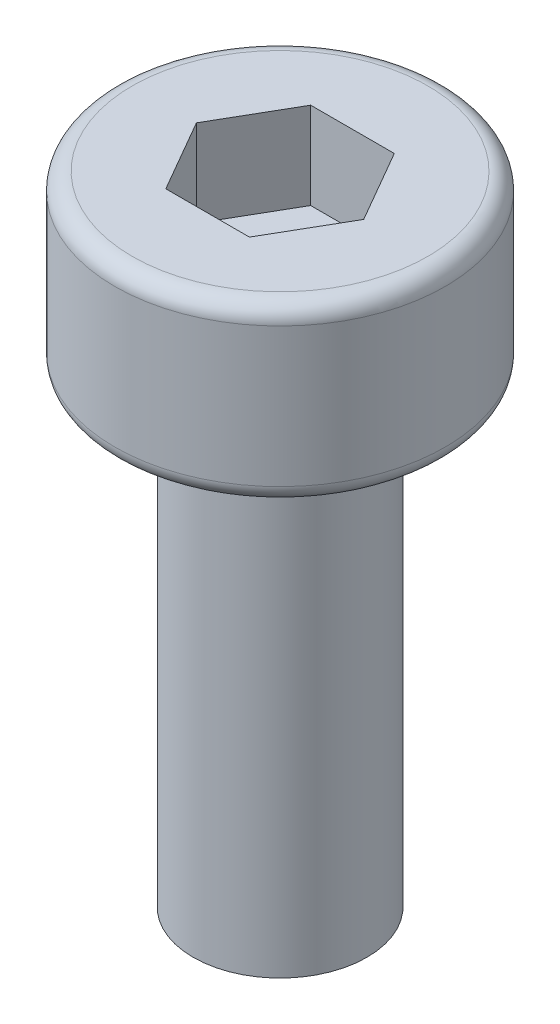
from build123d import *

# Parameters (mm, degrees)
SKETCH_1_R          = 2.85
EXTRUDE_1_DEPTH     = 3
SKETCH_2_R          = 1.5
EXTRUDE_2_DEPTH     = 8
FILLET_1_R          = 0.3
CUT_EXTRUDE_1_DEPTH = 1.5


with BuildPart() as part:
    # 草图1 → 凸台-拉伸1 (new body)
    with BuildSketch(Plane(origin=(0, 0, 0), x_dir=(1, 0, 0), z_dir=(0, 1, 0))):
        with Locations(Location((0, 0, 0), (0, 0, 270))):
            Circle(SKETCH_1_R)
    extrude(amount=EXTRUDE_1_DEPTH)

    # 草图2 → 凸台-拉伸2 (add)
    with BuildSketch(Plane.XZ):
        with Locations(Location((0, 0, 0), (0, 0, 90))):
            Circle(SKETCH_2_R)
    extrude(amount=EXTRUDE_2_DEPTH)

    # 圆角1
    fillet_1_edges = [part.edges().sort_by_distance(p)[0] for p in [
        (0, 0, -2.85),
        (0, 3, -2.85),
    ]]
    fillet(fillet_1_edges, radius=FILLET_1_R)

    # 草图3 → 切除-拉伸1 (cut)
    with BuildSketch(Plane(origin=(0, 3, 0), x_dir=(1, 0, 0), z_dir=(0, 1, 0))):
        Polygon((-1.443375673, 0), (-0.721687836, -1.25), (0.721687836, -1.25), (1.443375673, 0), (0.721687836, 1.25), (-0.721687836, 1.25), align=None)
    extrude(amount=-CUT_EXTRUDE_1_DEPTH, mode=Mode.SUBTRACT)


solid = part.part
